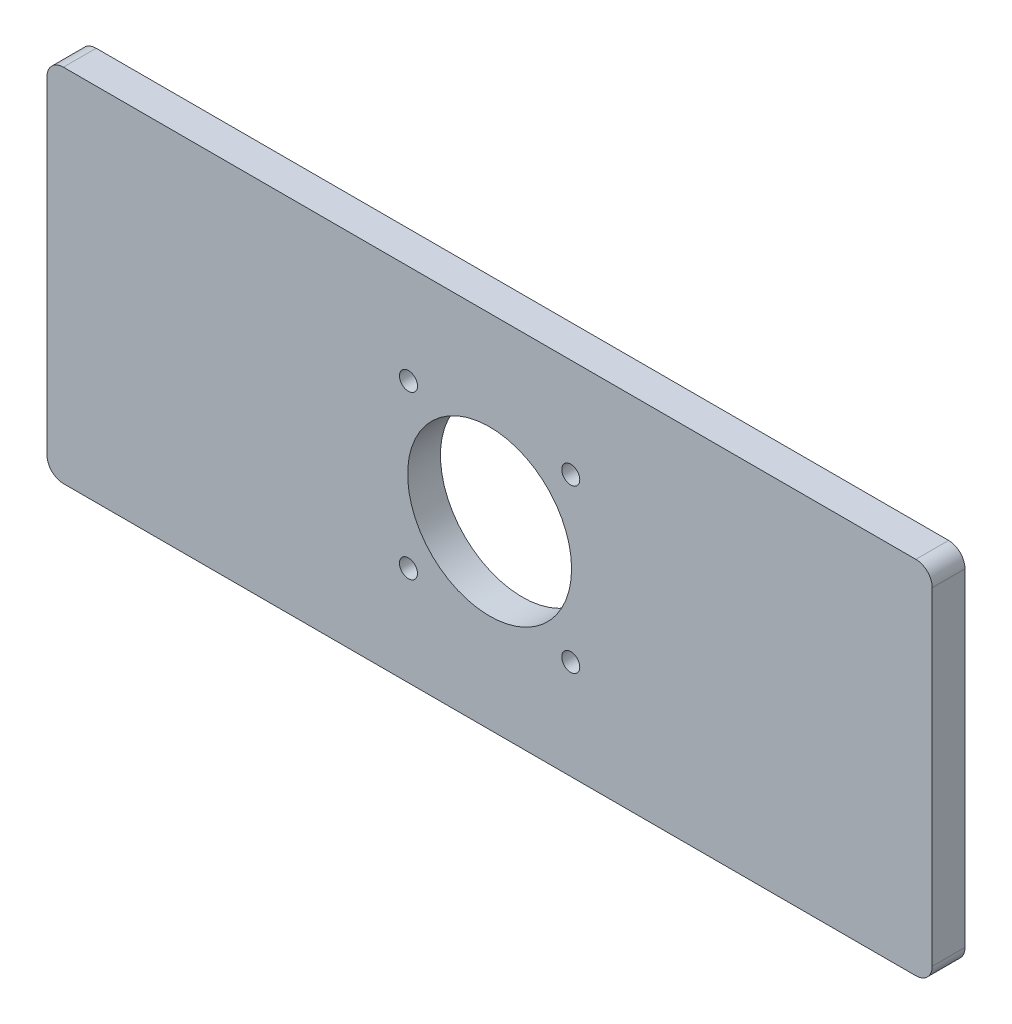
from build123d import *

# Parameters (mm, degrees)
BOSS_EXTRUDE1_DEPTH  = 10
SKETCH2_R            = 25
CUT_EXTRUDE1_DEPTH   = 776.358804999
M5_CLEARANCE_HOLE1_D = 5.5


with BuildPart() as part:
    # Sketch1 → Boss-Extrude1 (new body)
    with BuildSketch(Plane.XY):
        with BuildLine():
            Line((-55, 50), (-55, -50))
            ThreePointArc((-55, -50), (-53.535533906, -53.535533906), (-50, -55))
            Line((-50, -55), (210, -55))
            ThreePointArc((210, -55), (213.535533906, -53.535533906), (215, -50))
            Line((215, -50), (215, 50))
            ThreePointArc((215, 50), (213.535533906, 53.535533906), (210, 55))
            Line((210, 55), (-50, 55))
            ThreePointArc((-50, 55), (-53.535533906, 53.535533906), (-55, 50))
        make_face()
    extrude(amount=BOSS_EXTRUDE1_DEPTH)

    # Sketch2 → Cut-Extrude1 (cut, through all)
    with BuildSketch(Plane(origin=(-479.845790405, 288.904934605, 10), x_dir=(1, 0, 0), z_dir=(0, 0, 1))):
        with Locations((559.845790405, -288.904934605)):
            Circle(SKETCH2_R)
    extrude(amount=-CUT_EXTRUDE1_DEPTH, mode=Mode.SUBTRACT)

    # M5 Clearance Hole1 (through all)
    with Locations(Plane(origin=(-479.845790405, 288.904934605, 10), x_dir=(1, 0, 0), z_dir=(0, 0, 1))):
        with Locations((535.097053063, -264.156197264), (584.594527746, -264.156197264), (584.594527746, -313.653671947), (535.097053063, -313.653671947)):
            Hole(M5_CLEARANCE_HOLE1_D / 2)


solid = part.part
